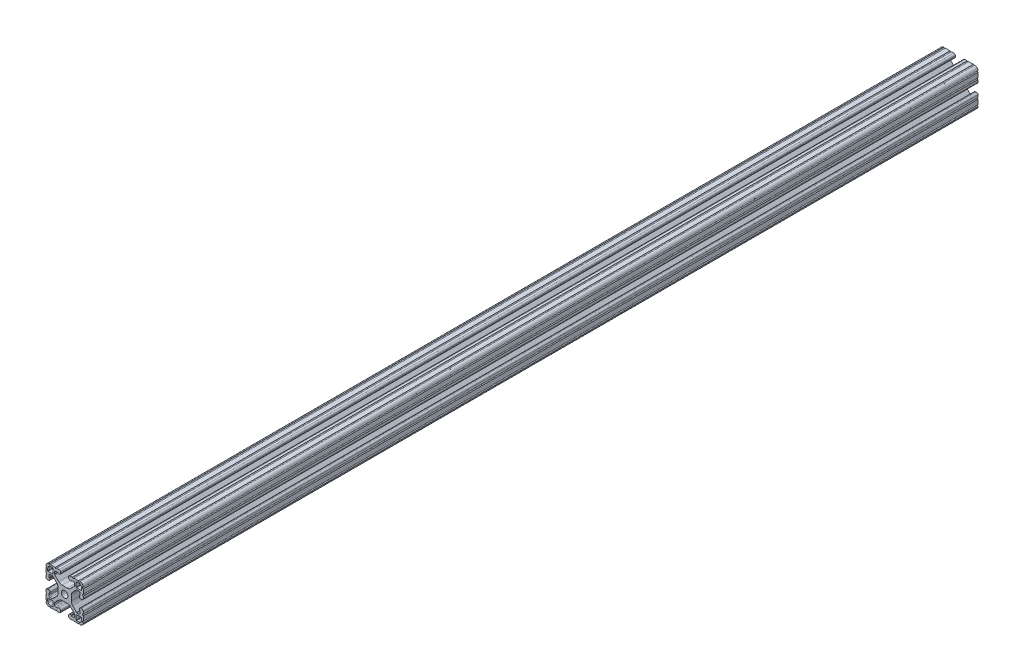
from build123d import *

# Parameters (mm, degrees)
SKETCH1_R      = 3.3274
EXTRUDE1_DEPTH = 914.4


with BuildPart() as part:
    # Sketch1 → Extrude1 (new body)
    with BuildSketch(Plane.XY):
        with BuildLine():
            Line((10.02670034, -12.151875049), (6.021451835, -8.147301292))
            ThreePointArc((6.021451835, -8.147301292), (4.48060392, -7.11788044), (2.663118988, -6.7564))
            Line((2.663118988, -6.7564), (-2.663118988, -6.7564))
            ThreePointArc((-2.663118988, -6.7564), (-4.48060392, -7.11788044), (-6.021451835, -8.147301292))
            Line((-6.021451835, -8.147301292), (-10.02670034, -12.151875049))
            ThreePointArc((-10.02670034, -12.151875049), (-10.219349756, -12.440155844), (-10.287, -12.78021916))
            Line((-10.287, -12.78021916), (-10.287, -14.55471092))
            ThreePointArc((-10.287, -14.55471092), (-9.915025612, -15.452736532), (-9.017, -15.82471092))
            Line((-9.017, -15.82471092), (-6.814144259, -15.82471092))
            Line((-6.814144259, -15.82471092), (-6.814144259, -14.986))
            Line((-6.814144259, -14.986), (-5.6388, -14.986))
            ThreePointArc((-5.6388, -14.986), (-4.525248241, -15.447248241), (-4.064, -16.5608))
            Line((-4.064, -16.5608), (-4.064, -17.4752))
            ThreePointArc((-4.064, -17.4752), (-4.525248241, -18.588751759), (-5.6388, -19.05))
            Line((-5.6388, -19.05), (-7.9756, -19.05))
            ThreePointArc((-7.9756, -19.05), (-8.7376, -18.288), (-9.4996, -19.05))
            Line((-9.4996, -19.05), (-14.3256, -19.05))
            ThreePointArc((-14.3256, -19.05), (-15.0876, -18.288), (-15.8496, -19.05))
            Line((-15.8496, -19.05), (-15.875, -19.05))
            ThreePointArc((-15.875, -19.05), (-18.12006403, -18.12006403), (-19.05, -15.875))
            Line((-19.05, -15.875), (-19.05, -15.8496))
            ThreePointArc((-19.05, -15.8496), (-18.288, -15.0876), (-19.05, -14.3256))
            Line((-19.05, -14.3256), (-19.05, -9.4996))
            ThreePointArc((-19.05, -9.4996), (-18.288, -8.7376), (-19.05, -7.9756))
            Line((-19.05, -7.9756), (-19.05, -5.6388))
            ThreePointArc((-19.05, -5.6388), (-18.588751759, -4.525248241), (-17.4752, -4.064))
            Line((-17.4752, -4.064), (-16.5608, -4.064))
            ThreePointArc((-16.5608, -4.064), (-15.447248241, -4.525248241), (-14.986, -5.6388))
            Line((-14.986, -5.6388), (-14.986, -6.750644259))
            Line((-14.986, -6.750644259), (-15.879033733, -6.750644259))
            Line((-15.879033733, -6.750644259), (-15.879033733, -8.919211783))
            ThreePointArc((-15.879033733, -8.919211783), (-15.507059345, -9.817237395), (-14.609033733, -10.189211783))
            Line((-14.609033733, -10.189211783), (-12.742784468, -10.189211783))
            ThreePointArc((-12.742784468, -10.189211783), (-12.402613491, -10.121555016), (-12.114219497, -9.928882664))
            Line((-12.114219497, -9.928882664), (-8.147867153, -5.963198517))
            ThreePointArc((-8.147867153, -5.963198517), (-7.118033561, -4.422154408), (-6.7564, -2.604299809))
            Line((-6.7564, -2.604299809), (-6.7564, 2.604299809))
            ThreePointArc((-6.7564, 2.604299809), (-7.118033561, 4.422154408), (-8.147867153, 5.963198517))
            Line((-8.147867153, 5.963198517), (-12.114219497, 9.928882664))
            ThreePointArc((-12.114219497, 9.928882664), (-12.402613491, 10.121555016), (-12.742784468, 10.189211783))
            Line((-12.742784468, 10.189211783), (-14.609033733, 10.189211783))
            ThreePointArc((-14.609033733, 10.189211783), (-15.507059345, 9.817237395), (-15.879033733, 8.919211783))
            Line((-15.879033733, 8.919211783), (-15.879033733, 6.750644259))
            Line((-15.879033733, 6.750644259), (-14.986, 6.750644259))
            Line((-14.986, 6.750644259), (-14.986, 5.6388))
            ThreePointArc((-14.986, 5.6388), (-15.447248241, 4.525248241), (-16.5608, 4.064))
            Line((-16.5608, 4.064), (-17.4752, 4.064))
            ThreePointArc((-17.4752, 4.064), (-18.588751759, 4.525248241), (-19.05, 5.6388))
            Line((-19.05, 5.6388), (-19.05, 7.9756))
            ThreePointArc((-19.05, 7.9756), (-18.288, 8.7376), (-19.05, 9.4996))
            Line((-19.05, 9.4996), (-19.05, 14.3256))
            ThreePointArc((-19.05, 14.3256), (-18.288, 15.0876), (-19.05, 15.8496))
            Line((-19.05, 15.8496), (-19.05, 15.875))
            ThreePointArc((-19.05, 15.875), (-18.12006403, 18.12006403), (-15.875, 19.05))
            Line((-15.875, 19.05), (-15.8496, 19.05))
            ThreePointArc((-15.8496, 19.05), (-15.0876, 18.288), (-14.3256, 19.05))
            Line((-14.3256, 19.05), (-9.4996, 19.05))
            ThreePointArc((-9.4996, 19.05), (-8.7376, 18.288), (-7.9756, 19.05))
            Line((-7.9756, 19.05), (-5.6388, 19.05))
            ThreePointArc((-5.6388, 19.05), (-4.525248241, 18.588751759), (-4.064, 17.4752))
            Line((-4.064, 17.4752), (-4.064, 16.5608))
            ThreePointArc((-4.064, 16.5608), (-4.525248241, 15.447248241), (-5.6388, 14.986))
            Line((-5.6388, 14.986), (-6.814144259, 14.986))
            Line((-6.814144259, 14.986), (-6.814144259, 15.82471092))
            Line((-6.814144259, 15.82471092), (-9.017, 15.82471092))
            ThreePointArc((-9.017, 15.82471092), (-9.915025612, 15.452736532), (-10.287, 14.55471092))
            Line((-10.287, 14.55471092), (-10.287, 12.78021916))
            ThreePointArc((-10.287, 12.78021916), (-10.219349756, 12.440155844), (-10.02670034, 12.151875049))
            Line((-10.02670034, 12.151875049), (-6.021451835, 8.147301292))
            ThreePointArc((-6.021451835, 8.147301292), (-4.48060392, 7.11788044), (-2.663118988, 6.7564))
            Line((-2.663118988, 6.7564), (2.663118988, 6.7564))
            ThreePointArc((2.663118988, 6.7564), (4.48060392, 7.11788044), (6.021451835, 8.147301292))
            Line((6.021451835, 8.147301292), (10.02670034, 12.151875049))
            ThreePointArc((10.02670034, 12.151875049), (10.219349756, 12.440155844), (10.287, 12.78021916))
            Line((10.287, 12.78021916), (10.287, 14.55471092))
            ThreePointArc((10.287, 14.55471092), (9.915025612, 15.452736532), (9.017, 15.82471092))
            Line((9.017, 15.82471092), (6.814144259, 15.82471092))
            Line((6.814144259, 15.82471092), (6.814144259, 14.986))
            Line((6.814144259, 14.986), (5.6388, 14.986))
            ThreePointArc((5.6388, 14.986), (4.525248241, 15.447248241), (4.064, 16.5608))
            Line((4.064, 16.5608), (4.064, 17.4752))
            ThreePointArc((4.064, 17.4752), (4.525248241, 18.588751759), (5.6388, 19.05))
            Line((5.6388, 19.05), (7.9756, 19.05))
            ThreePointArc((7.9756, 19.05), (8.7376, 18.288), (9.4996, 19.05))
            Line((9.4996, 19.05), (14.3256, 19.05))
            ThreePointArc((14.3256, 19.05), (15.0876, 18.288), (15.8496, 19.05))
            Line((15.8496, 19.05), (15.875, 19.05))
            ThreePointArc((15.875, 19.05), (18.12006403, 18.12006403), (19.05, 15.875))
            Line((19.05, 15.875), (19.05, 15.8496))
            ThreePointArc((19.05, 15.8496), (18.288, 15.0876), (19.05, 14.3256))
            Line((19.05, 14.3256), (19.05, 9.4996))
            ThreePointArc((19.05, 9.4996), (18.288, 8.7376), (19.05, 7.9756))
            Line((19.05, 7.9756), (19.05, 5.6388))
            ThreePointArc((19.05, 5.6388), (18.588751759, 4.525248241), (17.4752, 4.064))
            Line((17.4752, 4.064), (16.5608, 4.064))
            ThreePointArc((16.5608, 4.064), (15.447248241, 4.525248241), (14.986, 5.6388))
            Line((14.986, 5.6388), (14.986, 6.750644259))
            Line((14.986, 6.750644259), (15.879033733, 6.750644259))
            Line((15.879033733, 6.750644259), (15.879033733, 8.919211783))
            ThreePointArc((15.879033733, 8.919211783), (15.507059345, 9.817237395), (14.609033733, 10.189211783))
            Line((14.609033733, 10.189211783), (12.742784468, 10.189211783))
            ThreePointArc((12.742784468, 10.189211783), (12.402613491, 10.121555016), (12.114219497, 9.928882664))
            Line((12.114219497, 9.928882664), (8.147867153, 5.963198517))
            ThreePointArc((8.147867153, 5.963198517), (7.118033561, 4.422154408), (6.7564, 2.604299809))
            Line((6.7564, 2.604299809), (6.7564, -2.604299809))
            ThreePointArc((6.7564, -2.604299809), (7.118033561, -4.422154408), (8.147867153, -5.963198517))
            Line((8.147867153, -5.963198517), (12.114219497, -9.928882664))
            ThreePointArc((12.114219497, -9.928882664), (12.402613491, -10.121555016), (12.742784468, -10.189211783))
            Line((12.742784468, -10.189211783), (14.609033733, -10.189211783))
            ThreePointArc((14.609033733, -10.189211783), (15.507059345, -9.817237395), (15.879033733, -8.919211783))
            Line((15.879033733, -8.919211783), (15.879033733, -6.750644259))
            Line((15.879033733, -6.750644259), (14.986, -6.750644259))
            Line((14.986, -6.750644259), (14.986, -5.6388))
            ThreePointArc((14.986, -5.6388), (15.447248241, -4.525248241), (16.5608, -4.064))
            Line((16.5608, -4.064), (17.4752, -4.064))
            ThreePointArc((17.4752, -4.064), (18.588751759, -4.525248241), (19.05, -5.6388))
            Line((19.05, -5.6388), (19.05, -7.9756))
            ThreePointArc((19.05, -7.9756), (18.288, -8.7376), (19.05, -9.4996))
            Line((19.05, -9.4996), (19.05, -14.3256))
            ThreePointArc((19.05, -14.3256), (18.288, -15.0876), (19.05, -15.8496))
            Line((19.05, -15.8496), (19.05, -15.875))
            ThreePointArc((19.05, -15.875), (18.12006403, -18.12006403), (15.875, -19.05))
            Line((15.875, -19.05), (15.8496, -19.05))
            ThreePointArc((15.8496, -19.05), (15.0876, -18.288), (14.3256, -19.05))
            Line((14.3256, -19.05), (9.4996, -19.05))
            ThreePointArc((9.4996, -19.05), (8.7376, -18.288), (7.9756, -19.05))
            Line((7.9756, -19.05), (5.6388, -19.05))
            ThreePointArc((5.6388, -19.05), (4.525248241, -18.588751759), (4.064, -17.4752))
            Line((4.064, -17.4752), (4.064, -16.5608))
            ThreePointArc((4.064, -16.5608), (4.525248241, -15.447248241), (5.6388, -14.986))
            Line((5.6388, -14.986), (6.814144259, -14.986))
            Line((6.814144259, -14.986), (6.814144259, -15.82471092))
            Line((6.814144259, -15.82471092), (9.017, -15.82471092))
            ThreePointArc((9.017, -15.82471092), (9.915025612, -15.452736532), (10.287, -14.55471092))
            Line((10.287, -14.55471092), (10.287, -12.78021916))
            ThreePointArc((10.287, -12.78021916), (10.219349756, -12.440155844), (10.02670034, -12.151875049))
        make_face()
        Circle(SKETCH1_R, mode=Mode.SUBTRACT)
        with BuildLine():
            Line((16.891, -11.8618), (12.2428, -11.8618))
            ThreePointArc((12.2428, -11.8618), (11.973392316, -11.973392316), (11.8618, -12.2428))
            Line((11.8618, -12.2428), (11.8618, -16.891))
            ThreePointArc((11.8618, -16.891), (11.973392316, -17.160407684), (12.2428, -17.272))
            Line((12.2428, -17.272), (14.478, -17.272))
            ThreePointArc((14.478, -17.272), (16.453656347, -16.453656347), (17.272, -14.478))
            Line((17.272, -14.478), (17.272, -12.2428))
            ThreePointArc((17.272, -12.2428), (17.160407684, -11.973392316), (16.891, -11.8618))
        make_face(mode=Mode.SUBTRACT)
        with BuildLine():
            Line((17.272, 14.478), (17.272, 12.2428))
            ThreePointArc((17.272, 12.2428), (17.160407684, 11.973392316), (16.891, 11.8618))
            Line((16.891, 11.8618), (12.2428, 11.8618))
            ThreePointArc((12.2428, 11.8618), (11.973392316, 11.973392316), (11.8618, 12.2428))
            Line((11.8618, 12.2428), (11.8618, 16.891))
            ThreePointArc((11.8618, 16.891), (11.973392316, 17.160407684), (12.2428, 17.272))
            Line((12.2428, 17.272), (14.478, 17.272))
            ThreePointArc((14.478, 17.272), (16.453656347, 16.453656347), (17.272, 14.478))
        make_face(mode=Mode.SUBTRACT)
        with BuildLine():
            Line((-17.272, -14.478), (-17.272, -12.2428))
            ThreePointArc((-17.272, -12.2428), (-17.160407684, -11.973392316), (-16.891, -11.8618))
            Line((-16.891, -11.8618), (-12.2428, -11.8618))
            ThreePointArc((-12.2428, -11.8618), (-11.973392316, -11.973392316), (-11.8618, -12.2428))
            Line((-11.8618, -12.2428), (-11.8618, -16.891))
            ThreePointArc((-11.8618, -16.891), (-11.973392316, -17.160407684), (-12.2428, -17.272))
            Line((-12.2428, -17.272), (-14.478, -17.272))
            ThreePointArc((-14.478, -17.272), (-16.453656347, -16.453656347), (-17.272, -14.478))
        make_face(mode=Mode.SUBTRACT)
        with BuildLine():
            Line((-16.891, 11.8618), (-12.2428, 11.8618))
            ThreePointArc((-12.2428, 11.8618), (-11.973392316, 11.973392316), (-11.8618, 12.2428))
            Line((-11.8618, 12.2428), (-11.8618, 16.891))
            ThreePointArc((-11.8618, 16.891), (-11.973392316, 17.160407684), (-12.2428, 17.272))
            Line((-12.2428, 17.272), (-14.478, 17.272))
            ThreePointArc((-14.478, 17.272), (-16.453656347, 16.453656347), (-17.272, 14.478))
            Line((-17.272, 14.478), (-17.272, 12.2428))
            ThreePointArc((-17.272, 12.2428), (-17.160407684, 11.973392316), (-16.891, 11.8618))
        make_face(mode=Mode.SUBTRACT)
    extrude(amount=-EXTRUDE1_DEPTH)


solid = part.part
